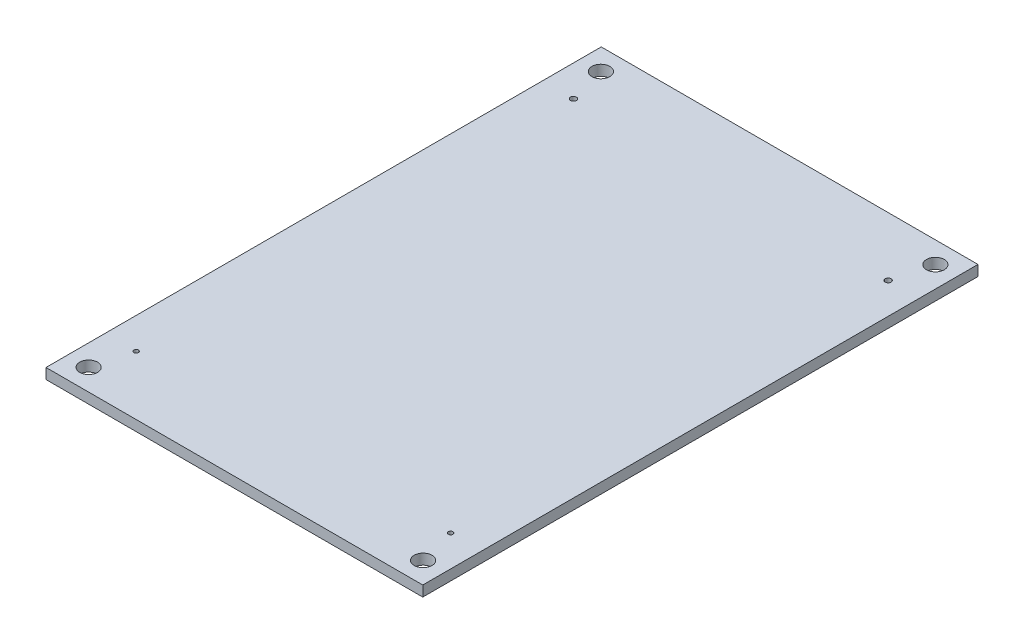
from build123d import *

# Parameters (mm, degrees)
SKETCH2_W      = 57
SKETCH2_H      = 84
SKETCH2_R      = 1.35
SKETCH2_R_2    = 0.35
SKETCH2_R_3    = 0.45
EXTRUDE1_DEPTH = 0.79375


with BuildPart() as part:
    # Sketch2 → Extrude1 (new, symmetric)
    with BuildSketch(Plane(origin=(0, 0, 0), x_dir=(1, 0, 0), z_dir=(0, 1, 0))):
        Rectangle(SKETCH2_W, SKETCH2_H)
        with Locations(Location((25.3, 38.75, 0), (0, 0, 270))):
            Circle(SKETCH2_R, mode=Mode.SUBTRACT)
        with Locations(Location((25.3, -38.75, 0), (0, 0, 270))):
            Circle(SKETCH2_R, mode=Mode.SUBTRACT)
        with Locations(Location((-25.3, -38.75, 0), (0, 0, 270))):
            Circle(SKETCH2_R, mode=Mode.SUBTRACT)
        with Locations(Location((-25.3, 38.75, 0), (0, 0, 270))):
            Circle(SKETCH2_R, mode=Mode.SUBTRACT)
        with Locations(Location((23.8, -33.07, 0), (0, 0, 270))):
            Circle(SKETCH2_R_2, mode=Mode.SUBTRACT)
        with Locations(Location((-23.8, -33.07, 0), (0, 0, 270))):
            Circle(SKETCH2_R_2, mode=Mode.SUBTRACT)
        with Locations(Location((23.8, 33.1, 0), (0, 0, 270))):
            Circle(SKETCH2_R_3, mode=Mode.SUBTRACT)
        with Locations(Location((-23.8, 33.1, 0), (0, 0, 270))):
            Circle(SKETCH2_R_3, mode=Mode.SUBTRACT)
    extrude(amount=EXTRUDE1_DEPTH, both=True)


solid = part.part
